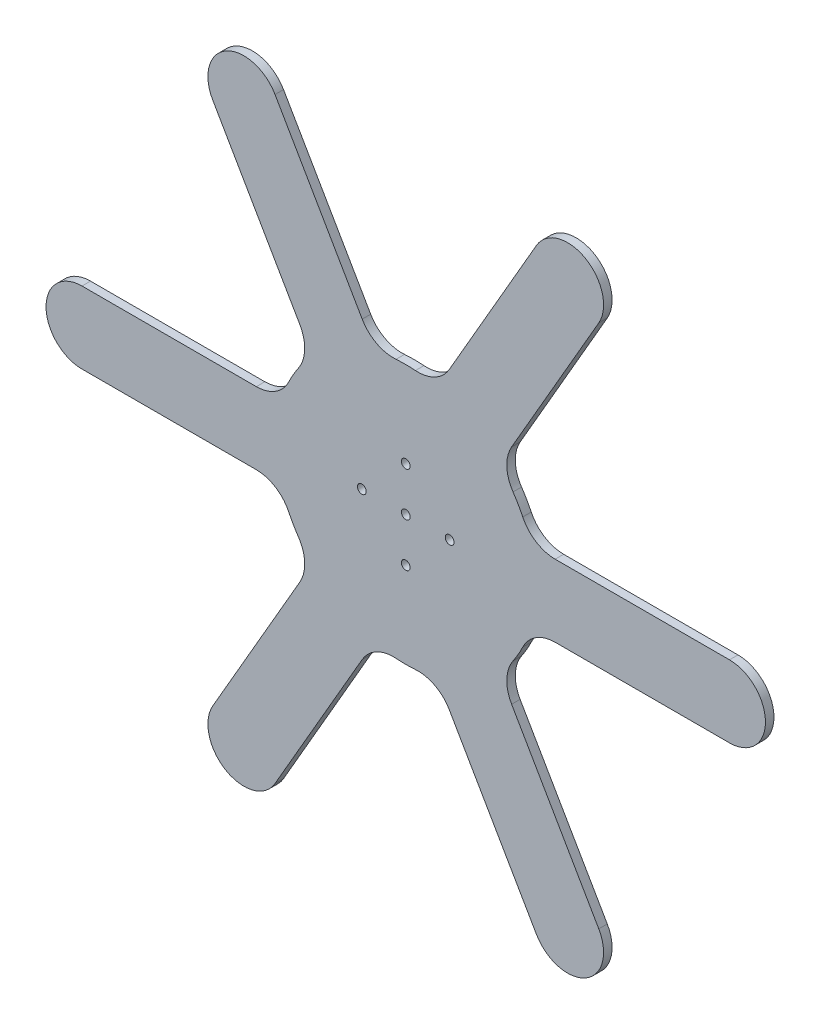
from build123d import *

# Parameters (mm, degrees)
CROQUIS1_R              = 1.55
SALIENTE_EXTRUIR1_DEPTH = 1.5


with BuildPart() as part:
    # Croquis1 → Saliente-Extruir1 (new, symmetric)
    with BuildSketch(Plane.XY):
        with BuildLine():
            Line((-52.753601773, 12.7), (-114.3, 12.7))
            ThreePointArc((-114.3, 12.7), (-127, 0), (-114.3, -12.7))
            Line((-114.3, -12.7), (-52.753601773, -12.7))
            ThreePointArc((-52.753601773, -12.7), (-45.996397628, -14.646851989), (-41.310890543, -19.890520922))
            ThreePointArc((-41.310890543, -19.890520922), (-39.707264764, -22.925), (-37.881141685, -25.831020202))
            ThreePointArc((-37.881141685, -25.831020202), (-35.682744722, -32.510622834), (-37.375323514, -39.335959276))
            Line((-37.375323514, -39.335959276), (-68.148522628, -92.636703653))
            ThreePointArc((-68.148522628, -92.636703653), (-63.5, -109.985226281), (-46.151477372, -105.336703653))
            Line((-46.151477372, -105.336703653), (-15.378278258, -52.035959276))
            ThreePointArc((-15.378278258, -52.035959276), (-10.313652906, -47.157474823), (-3.429748858, -45.721541124))
            ThreePointArc((-3.429748858, -45.721541124), (0, -45.85), (3.429748858, -45.721541124))
            ThreePointArc((3.429748858, -45.721541124), (10.313652906, -47.157474823), (15.378278258, -52.035959276))
            Line((15.378278258, -52.035959276), (46.151477372, -105.336703653))
            ThreePointArc((46.151477372, -105.336703653), (63.5, -109.985226281), (68.148522628, -92.636703653))
            Line((68.148522628, -92.636703653), (37.375323514, -39.335959276))
            ThreePointArc((37.375323514, -39.335959276), (35.682744722, -32.510622834), (37.881141685, -25.831020202))
            ThreePointArc((37.881141685, -25.831020202), (39.707264764, -22.925), (41.310890543, -19.890520922))
            ThreePointArc((41.310890543, -19.890520922), (45.996397628, -14.646851989), (52.753601773, -12.7))
            Line((52.753601773, -12.7), (114.3, -12.7))
            ThreePointArc((114.3, -12.7), (127, 0), (114.3, 12.7))
            Line((114.3, 12.7), (52.753601773, 12.7))
            ThreePointArc((52.753601773, 12.7), (45.996397628, 14.646851989), (41.310890543, 19.890520922))
            ThreePointArc((41.310890543, 19.890520922), (39.707264764, 22.925), (37.881141685, 25.831020202))
            ThreePointArc((37.881141685, 25.831020202), (35.682744722, 32.510622834), (37.375323514, 39.335959276))
            Line((37.375323514, 39.335959276), (68.148522628, 92.636703653))
            ThreePointArc((68.148522628, 92.636703653), (63.5, 109.985226281), (46.151477372, 105.336703653))
            Line((46.151477372, 105.336703653), (15.378278258, 52.035959276))
            ThreePointArc((15.378278258, 52.035959276), (10.313652906, 47.157474823), (3.429748858, 45.721541124))
            ThreePointArc((3.429748858, 45.721541124), (0, 45.85), (-3.429748858, 45.721541124))
            ThreePointArc((-3.429748858, 45.721541124), (-10.313652906, 47.157474823), (-15.378278258, 52.035959276))
            Line((-15.378278258, 52.035959276), (-46.151477372, 105.336703653))
            ThreePointArc((-46.151477372, 105.336703653), (-63.5, 109.985226281), (-68.148522628, 92.636703653))
            Line((-68.148522628, 92.636703653), (-37.375323514, 39.335959276))
            ThreePointArc((-37.375323514, 39.335959276), (-35.682744722, 32.510622834), (-37.881141685, 25.831020202))
            ThreePointArc((-37.881141685, 25.831020202), (-39.707264764, 22.925), (-41.310890543, 19.890520922))
            ThreePointArc((-41.310890543, 19.890520922), (-45.996397628, 14.646851989), (-52.753601773, 12.7))
        make_face()
        Circle(CROQUIS1_R, mode=Mode.SUBTRACT)
        with Locations((0, 15.5)):
            Circle(CROQUIS1_R, mode=Mode.SUBTRACT)
        with Locations((15.5, 0)):
            Circle(CROQUIS1_R, mode=Mode.SUBTRACT)
        with Locations((0, -15.5)):
            Circle(CROQUIS1_R, mode=Mode.SUBTRACT)
        with Locations((-15.5, 0)):
            Circle(CROQUIS1_R, mode=Mode.SUBTRACT)
    extrude(amount=SALIENTE_EXTRUIR1_DEPTH, both=True)


solid = part.part
